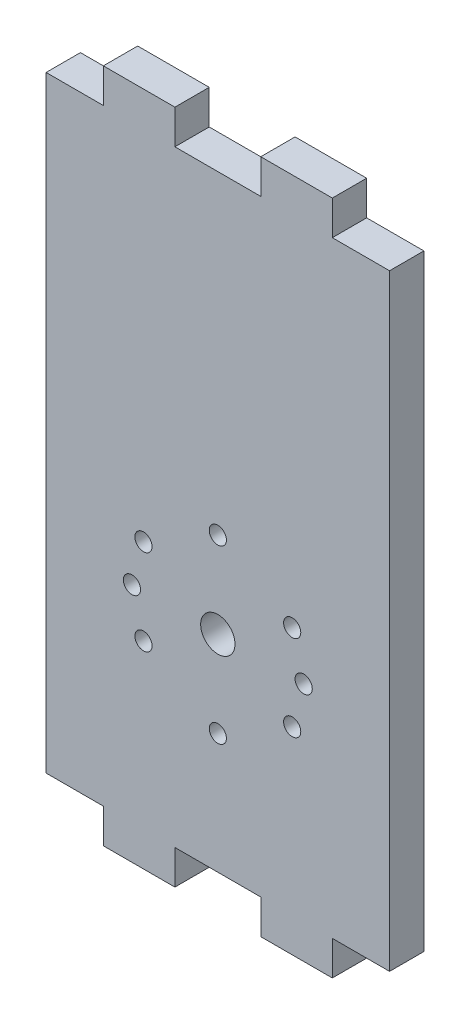
from build123d import *

# Parameters (mm, degrees)
SKETCH1_R           = 0.75
SKETCH1_R_2         = 1.5
BOSS_EXTRUDE1_DEPTH = 3


with BuildPart() as part:
    # Sketch1 → Boss-Extrude1 (new body)
    with BuildSketch(Plane.XY):
        Polygon((-15, 26.5), (-10, 26.5), (-10, 29.5), (-3.75, 29.5), (-3.75, 26.5), (3.75, 26.5), (3.75, 29.5), (10, 29.5), (10, 26.5), (15, 26.5), (15, -26.5), (10, -26.5), (10, -29.5), (3.75, -29.5), (3.75, -26.5), (-3.75, -26.5), (-3.75, -29.5), (-10, -29.5), (-10, -26.5), (-15, -26.5), align=None)
        with Locations((0, -1)):
            Circle(SKETCH1_R, mode=Mode.SUBTRACT)
        with Locations((6.495190528, -4.75)):
            Circle(SKETCH1_R, mode=Mode.SUBTRACT)
        with Locations((6.495190528, -12.25)):
            Circle(SKETCH1_R, mode=Mode.SUBTRACT)
        with Locations((0, -16)):
            Circle(SKETCH1_R, mode=Mode.SUBTRACT)
        with Locations((-6.495190528, -12.25)):
            Circle(SKETCH1_R, mode=Mode.SUBTRACT)
        with Locations((-6.495190528, -4.75)):
            Circle(SKETCH1_R, mode=Mode.SUBTRACT)
        with Locations((0, -8.5)):
            Circle(SKETCH1_R_2, mode=Mode.SUBTRACT)
        with Locations((-7.5, -8.5)):
            Circle(SKETCH1_R, mode=Mode.SUBTRACT)
        with Locations((7.5, -8.5)):
            Circle(SKETCH1_R, mode=Mode.SUBTRACT)
    extrude(amount=BOSS_EXTRUDE1_DEPTH)


solid = part.part
